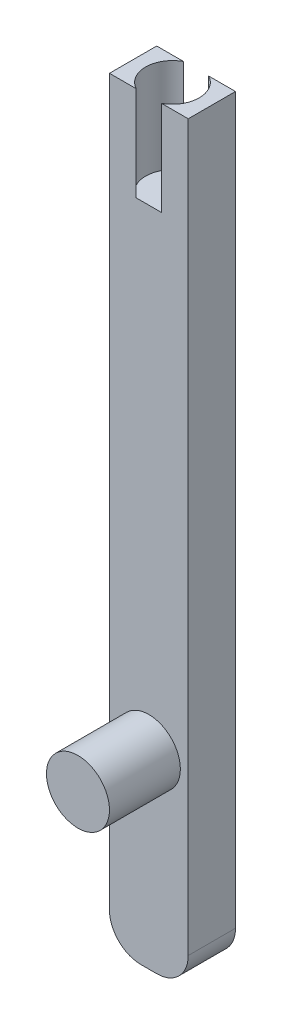
from build123d import *

# Parameters (mm, degrees)
EXTRUDE_1_DEPTH     = 1.5
SKETCH_2_R          = 1
EXTRUDE_2_DEPTH     = 2.25
SKETCH_3_R          = 0.85
CUT_EXTRUDE_1_DEPTH = 3


with BuildPart() as part:
    # Эскиз1 → Бобышка-Вытянуть1 (new body)
    with BuildSketch(Plane.XY):
        with BuildLine():
            Line((-1, 0), (-1.5, 0))
            ThreePointArc((-1.5, 0), (-2.207106781, 0.292893219), (-2.5, 1))
            Line((-2.5, 1), (-2.5, 24))
            Line((-2.5, 24), (0, 24))
            Line((0, 24), (0, 1))
            ThreePointArc((0, 1), (-0.292893219, 0.292893219), (-1, 0))
        make_face()
    extrude(amount=EXTRUDE_1_DEPTH)

    # Эскиз2 → Бобышка-Вытянуть2 (add)
    with BuildSketch(Plane.XY.offset(1.5)):
        with Locations((-1.25, 6)):
            Circle(SKETCH_2_R)
    extrude(amount=EXTRUDE_2_DEPTH)

    # Эскиз3 → Вырез-Вытянуть1 (cut)
    with BuildSketch(Plane(origin=(0, 24, 0), x_dir=(1, 0, 0), z_dir=(0, 1, 0))):
        with Locations((-1.25, -0.75)):
            Circle(SKETCH_3_R)
    extrude(amount=-CUT_EXTRUDE_1_DEPTH, mode=Mode.SUBTRACT)


solid = part.part
